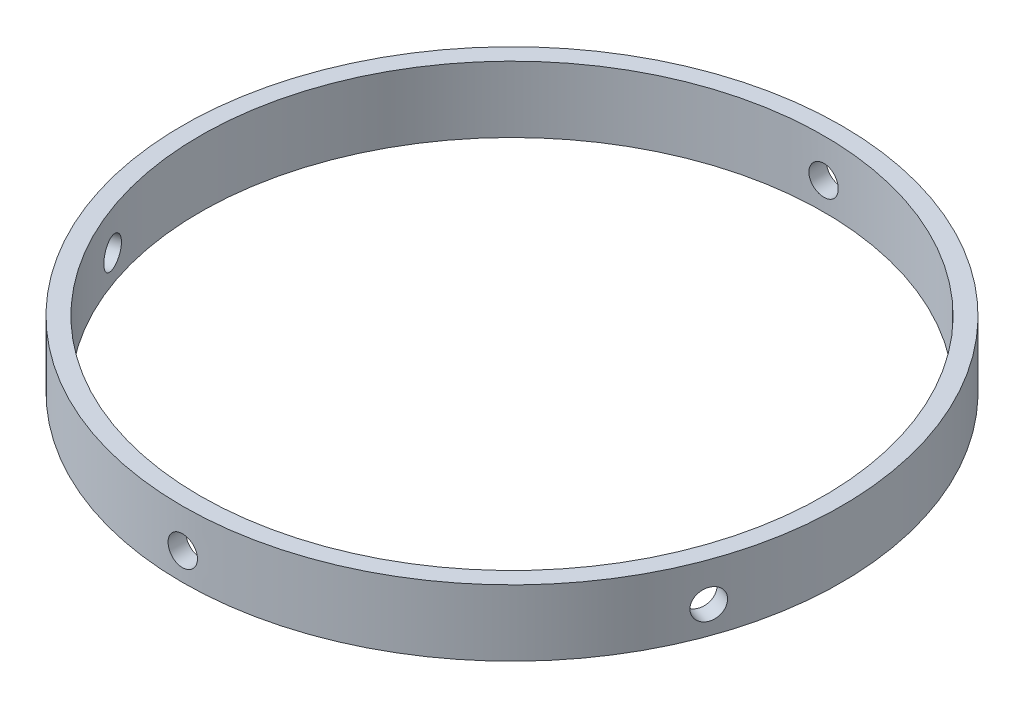
from build123d import *

# Parameters (mm, degrees)
SKETCH1_R                       = 37.973
SKETCH1_R_2                     = 35.941
BOSS_EXTRUDE1_DEPTH             = 7.62
SKETCH2_R                       = 1.692869147
CUT_EXTRUDE1_DEPTH              = 86.62
CIRPATTERN1_COUNT               = 2
CIRPATTERN2_COUNT               = 2
CIRPATTERN2_ANGLE               = 70
CIRPATTERN2_THE_OTHER_WAY_COUNT = 2
CIRPATTERN2_THE_OTHER_WAY_ANGLE = 70


with BuildPart() as part:
    # Sketch1 → Boss-Extrude1 (new body)
    with BuildSketch(Plane(origin=(0, 0, 0), x_dir=(1, 0, 0), z_dir=(0, 1, 0))):
        with Locations(Location((0, 0, 0), (0, 0, 90))):
            Circle(SKETCH1_R)
        with Locations(Location((0, 0, 0), (0, 0, 90))):
            Circle(SKETCH1_R_2, mode=Mode.SUBTRACT)
    extrude(amount=BOSS_EXTRUDE1_DEPTH)

    # Sketch2 → Cut-Extrude1 (cut)
    with BuildSketch(Plane.XY):
        with Locations(Location((0, 3.171011831, 0), (0, 0, 180))):
            Circle(SKETCH2_R)
    cut_extrude1 = extrude(amount=CUT_EXTRUDE1_DEPTH, mode=Mode.SUBTRACT)

    # CirPattern1: Cut-Extrude1 ×2 about axis
    cirpattern1_axis = Axis((0, 7.62, 0), (0, -1, 0))
    for i in range(1, CIRPATTERN1_COUNT):
        add(cut_extrude1.rotate(cirpattern1_axis, i * 360 / CIRPATTERN1_COUNT), mode=Mode.SUBTRACT)

    # CirPattern2: Cut-Extrude1 ×2 about axis
    cirpattern2_axis = Axis((0, 7.62, 0), (0, 1, 0))
    for i in range(1, CIRPATTERN2_COUNT):
        add(cut_extrude1.rotate(cirpattern2_axis, i * CIRPATTERN2_ANGLE / (CIRPATTERN2_COUNT - 1)), mode=Mode.SUBTRACT)

    # CirPattern2 the other way: Cut-Extrude1 ×2 about axis
    cirpattern2_the_other_way_axis = Axis((0, 7.62, 0), (0, -1, 0))
    for i in range(1, CIRPATTERN2_THE_OTHER_WAY_COUNT):
        add(cut_extrude1.rotate(cirpattern2_the_other_way_axis, i * CIRPATTERN2_THE_OTHER_WAY_ANGLE / (CIRPATTERN2_THE_OTHER_WAY_COUNT - 1)), mode=Mode.SUBTRACT)


solid = part.part
